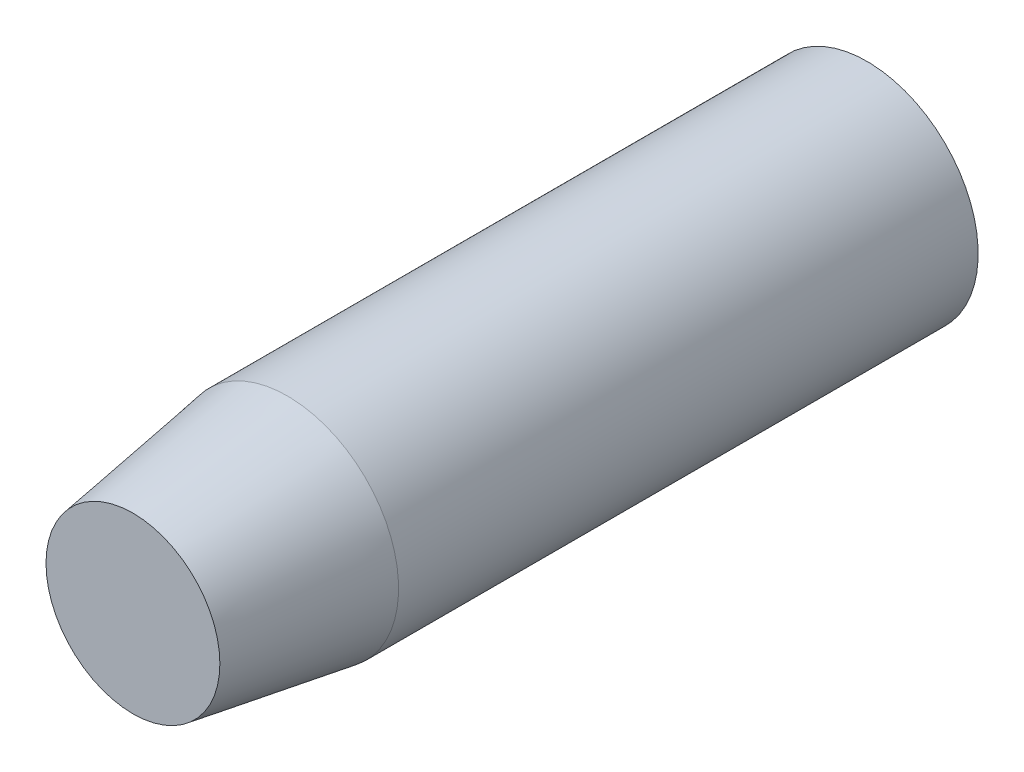
from build123d import *

# Parameters (mm, degrees)
SKETCH1_R           = 18.25625
BOSS_EXTRUDE1_DEPTH = 60.325
CHAMFER1_SIZE       = 25.4
CHAMFER1_SIZE2      = 3.96875


with BuildPart() as part:
    # Sketch1 → Boss-Extrude1 (new, symmetric)
    with BuildSketch(Plane.XY):
        with Locations(Location((0, 0, 0), (0, 0, 180))):
            Circle(SKETCH1_R)
    extrude(amount=BOSS_EXTRUDE1_DEPTH, both=True)

    # Chamfer1
    chamfer1_edges = [part.edges().sort_by_distance(p)[0] for p in [
        (18.25625, 0, 60.325),
    ]]
    chamfer1_side = [part.faces().sort_by_distance(p)[0] for p in [
        (18.25625, 0, 0),
    ]]
    chamfer(chamfer1_edges, length=CHAMFER1_SIZE, length2=CHAMFER1_SIZE2, reference=chamfer1_side[0])


solid = part.part
